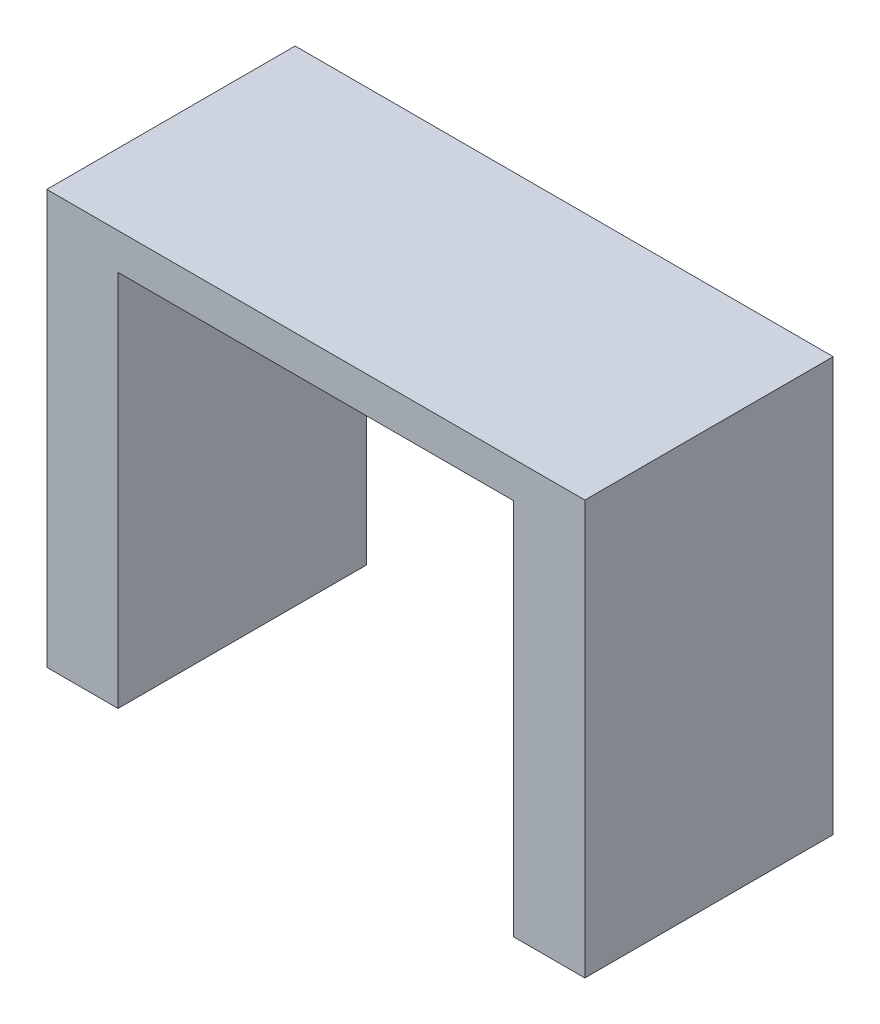
from build123d import *

# Parameters (mm, degrees)
CROQUIS1_W              = 13
CROQUIS1_H              = 6
SALIENTE_EXTRUIR1_DEPTH = 10
CROQUIS2_W              = 9.55730024
CROQUIS2_H              = 9.124408829
CORTAR_EXTRUIR1_DEPTH   = 10


with BuildPart() as part:
    # Croquis1 → Saliente-Extruir1 (new body)
    with BuildSketch(Plane(origin=(0, 0, 0), x_dir=(1, 0, 0), z_dir=(0, 1, 0))):
        Rectangle(CROQUIS1_W, CROQUIS1_H)
    extrude(amount=SALIENTE_EXTRUIR1_DEPTH)

    # Croquis2 → Cortar-Extruir1 (cut)
    with BuildSketch(Plane.XY.offset(3)):
        with Locations((0, 4.562204415)):
            Rectangle(CROQUIS2_W, CROQUIS2_H)
    extrude(amount=-CORTAR_EXTRUIR1_DEPTH, mode=Mode.SUBTRACT)


solid = part.part
